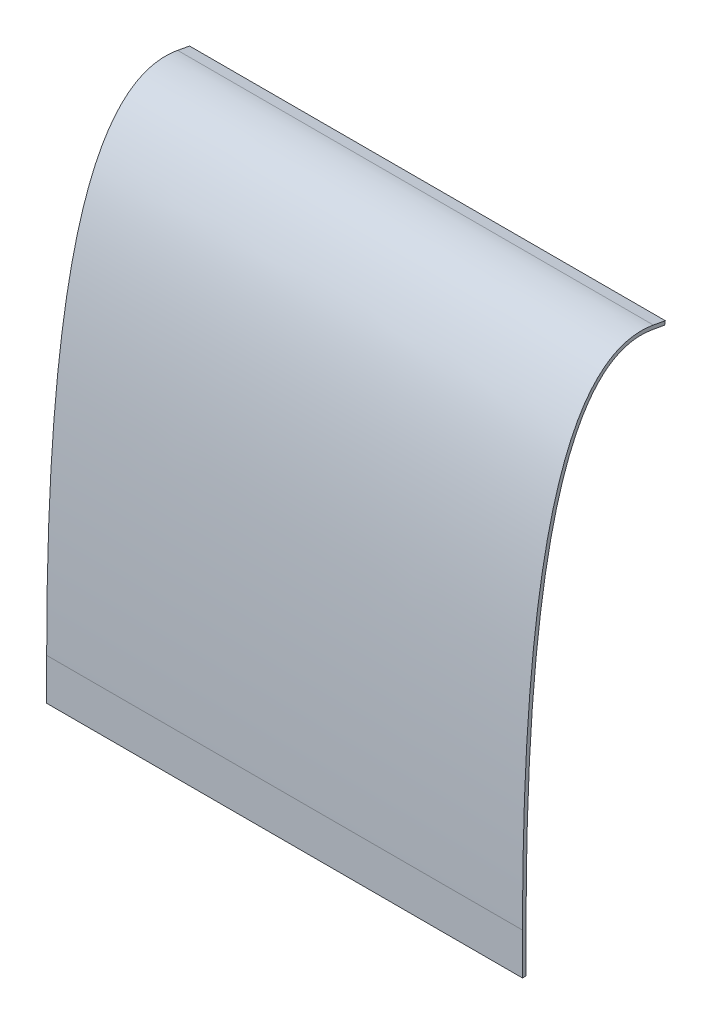
from build123d import *

# Parameters (mm, degrees)
SKETCH1_W           = 418.07892
SKETCH1_H           = 36.484920898
BOSS_EXTRUDE1_DEPTH = 3.175


with BuildPart() as part:
    # Sketch1 → Boss-Extrude1 (new body)
    with BuildSketch(Plane.XY):
        with Locations((209.03946, -5356.411291394)):
            Rectangle(SKETCH1_W, SKETCH1_H)
    extrude(amount=BOSS_EXTRUDE1_DEPTH)

    # Sweep1: sweep along a curve in space
    with BuildLine() as sweep1_path:
        Line((418.07892, -5338.168830945, 0), (0, -5338.168830945, 0))
    # Sketch7 → Sweep1 (sweep)
    with BuildSketch(Plane.ZY):
        with BuildLine():
            Line((-111.330615302, -4938.421114276), (-121.798132423, -4940.338680499))
            Line((-121.798132423, -4940.338680499), (-122.370246605, -4937.215651463))
            Line((-122.370246605, -4937.215651463), (-111.902729484, -4935.298085239))
            add(Edge.make_bspline(
                [(3.175, -5338.168830945), (3.175, -5335.987340768), (3.170465411, -5331.611375202), (3.143256962, -5322.963354035), (3.075233484, -5312.276385749), (2.939178486, -5299.671407322), (2.685193541, -5283.149253537), (2.231609699, -5263.033587898), (1.469474893, -5239.752652062), (0.489420195, -5217.329633102), (-1.108022954, -5188.575658793), (-3.650209462, -5154.776275246), (-7.574872597, -5117.642633017), (-12.375948375, -5083.930165151), (-18.056948382, -5053.632874569), (-26.814336297, -5017.779310899), (-37.360530821, -4988.718612896), (-49.795766977, -4966.398851205), (-60.121348091, -4953.027343833), (-71.513011288, -4943.058713534), (-81.923670653, -4937.680846083), (-90.753377806, -4935.206562348), (-97.597956352, -4934.271610019), (-103.474595102, -4934.259450376), (-108.25392015, -4934.701542264), (-110.696774931, -4935.077163917), (-111.902729484, -4935.298085239)],
                knots=[0.490445447, 0.490445447, 0.490445447, 0.490445447, 0.490528714, 0.490611981, 0.490778515, 0.490945049, 0.491111583, 0.491444651, 0.49177772, 0.492110788, 0.492443856, 0.493109992, 0.493776128, 0.494442265, 0.495108401, 0.495774537, 0.49710681, 0.497772946, 0.498439083, 0.499105219, 0.499771355, 0.500104423, 0.500437491, 0.50077056, 0.500937094, 0.501103628, 0.501103628, 0.501103628, 0.501103628], degree=3))
            Line((3.175, -5338.168830945), (0, -5338.168830945))
            add(Edge.make_bspline(
                [(0, -5338.168830945), (0, -4918.026227399), (-111.330615302, -4938.421114276)],
                knots=[0, 0, 0, 1, 1, 1], degree=2))
        make_face()
    sweep(path=sweep1_path.line)


solid = part.part
